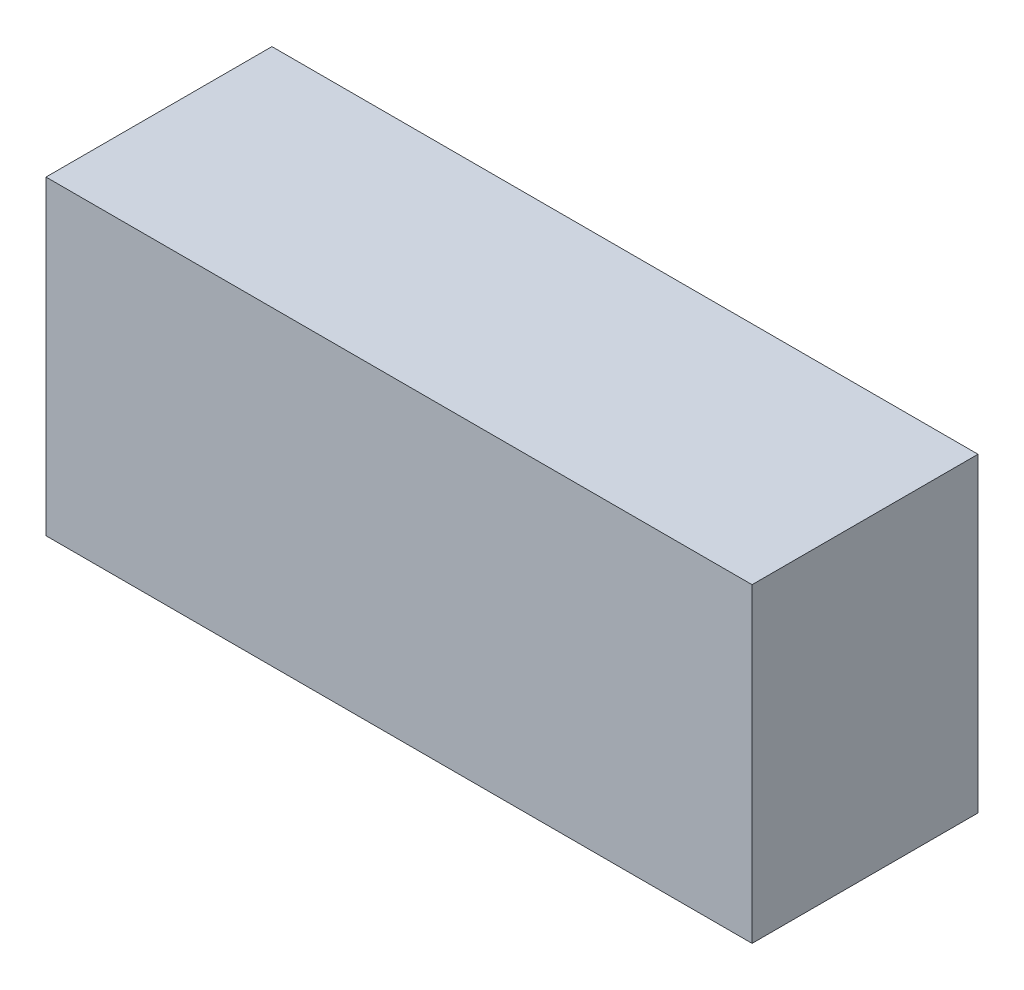
from build123d import *

# Parameters (mm, degrees)
SKETCH1_W                                  = 50
SKETCH1_H                                  = 22
REFERENCE_ENVELOPE_NOT_MANUFACTURING_DEPTH = 16


with BuildPart() as part:
    # Sketch1 → REFERENCE_ENVELOPE_NOT_MANUFACTURING (new body)
    with BuildSketch(Plane.XY):
        Rectangle(SKETCH1_W, SKETCH1_H)
    extrude(amount=REFERENCE_ENVELOPE_NOT_MANUFACTURING_DEPTH)


solid = part.part
